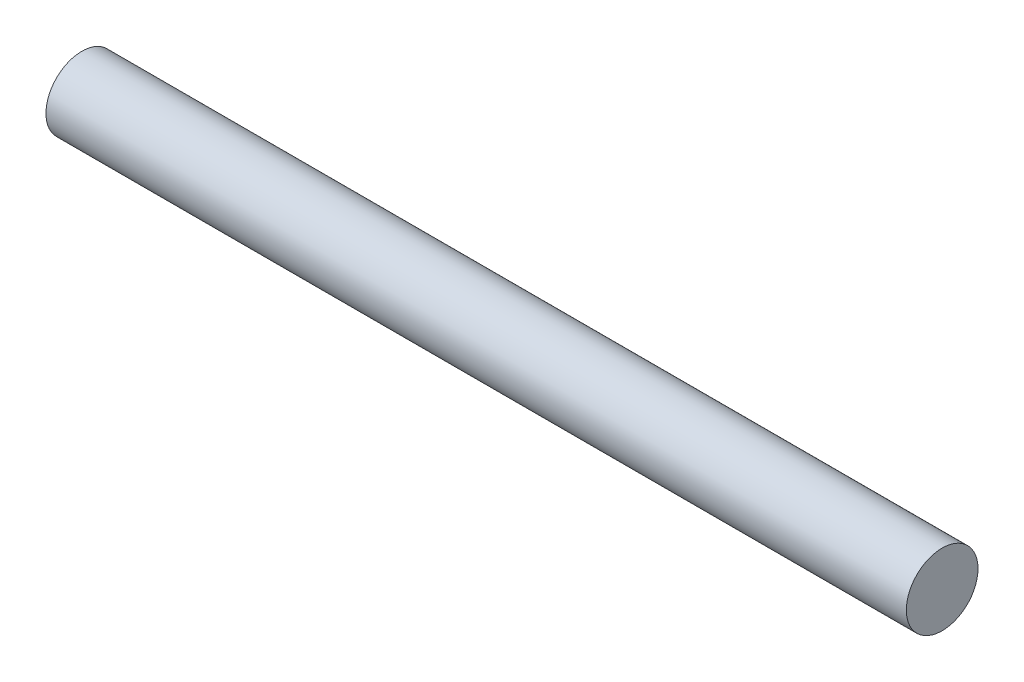
from build123d import *

# Parameters (mm, degrees)
SKETCH1_R           = 2.38125
BOSS_EXTRUDE1_DEPTH = 28.575


with BuildPart() as part:
    # Sketch1 → Boss-Extrude1 (new, symmetric)
    with BuildSketch(Plane(origin=(0, 0, 0), x_dir=(0, 0, -1), z_dir=(1, 0, 0))):
        Circle(SKETCH1_R)
    extrude(amount=BOSS_EXTRUDE1_DEPTH, both=True)


solid = part.part
